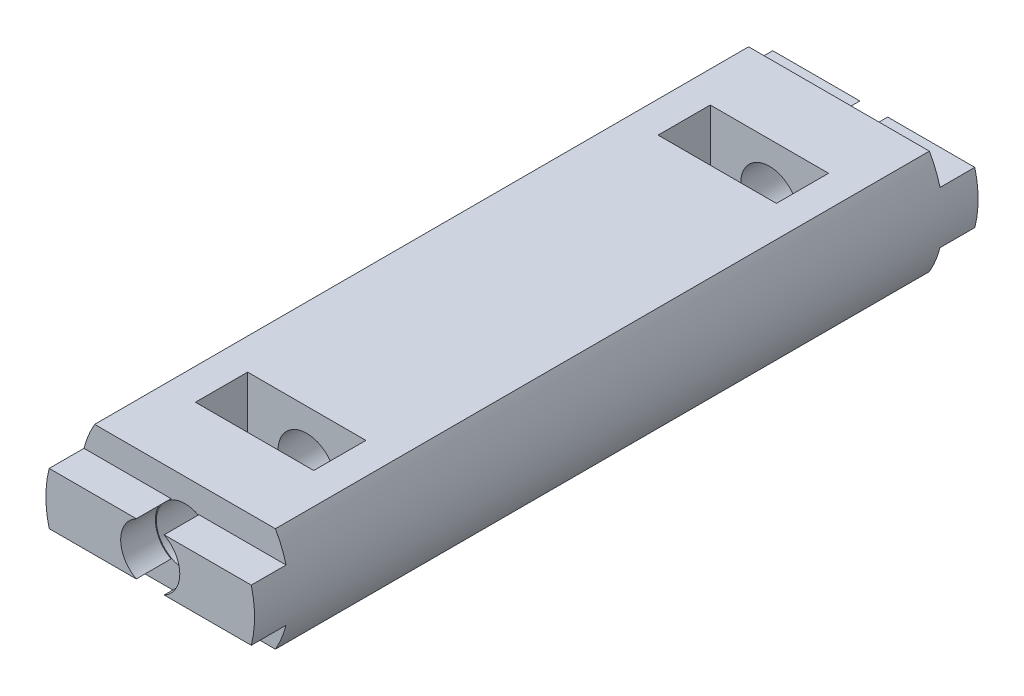
from build123d import *

# Parameters (mm, degrees)
ESBO_O1_R                     = 1.65
RESSALTO_EXTRUS_O1_DEPTH      = 37.6
RESSALTO_EXTRUS_O2_DEPTH      = 2
RESSALTO_EXTRUS_O2_DEPTH_BACK = 39.6
CORTE_EXTRUS_O1_DEPTH         = 41.164163131
CORTE_EXTRUS_O1_DEPTH_BACK    = 41.164163131
ESBO_O2_W                     = 6.8
ESBO_O2_H                     = 3


with BuildPart() as part:
    # Esboço1 → Ressalto-extrusão1 (new body)
    with BuildSketch(Plane.XY):
        with BuildLine():
            Line((-5.196152423, -3), (5.196152423, -3))
            ThreePointArc((5.196152423, -3), (6, 0), (5.196152423, 3))
            Line((5.196152423, 3), (-5.196152423, 3))
            ThreePointArc((-5.196152423, 3), (-6, 0), (-5.196152423, -3))
        make_face()
        Circle(ESBO_O1_R, mode=Mode.SUBTRACT)
    extrude(amount=RESSALTO_EXTRUS_O1_DEPTH)

    # Esboço3 → Ressalto-extrusão2 (add, two sides: drawn at the far end of the back side and taken through both)
    with BuildSketch(Plane(origin=(0, 0, 0), x_dir=(-1, 0, 0), z_dir=(0, 0, -1)).offset(-RESSALTO_EXTRUS_O2_DEPTH_BACK)):
        with BuildLine():
            Line((0.8, 1.5), (5.809475019, 1.5))
            ThreePointArc((5.809475019, 1.5), (6, 0), (5.809475019, -1.5))
            Line((5.809475019, -1.5), (0.8, -1.5))
            ThreePointArc((0.8, -1.5), (1.7, 0), (0.8, 1.5))
        make_face()
        with BuildLine():
            Line((-5.809475019, 1.5), (-0.8, 1.5))
            ThreePointArc((-0.8, 1.5), (-1.7, 0), (-0.8, -1.5))
            Line((-0.8, -1.5), (-5.809475019, -1.5))
            ThreePointArc((-5.809475019, -1.5), (-6, 0), (-5.809475019, 1.5))
        make_face()
    extrude(amount=RESSALTO_EXTRUS_O2_DEPTH + RESSALTO_EXTRUS_O2_DEPTH_BACK)

    # Esboço2 → Corte-extrusão1 (cut, two sides: drawn at the far end of the back side and taken through both)
    with BuildSketch(Plane(origin=(0, 0, 0), x_dir=(1, 0, 0), z_dir=(0, 1, 0)).offset(-CORTE_EXTRUS_O1_DEPTH_BACK)):
        with Locations((0, -5.5)):
            Rectangle(ESBO_O2_W, ESBO_O2_H)
        with Locations((0, -5.5)):
            Rectangle(ESBO_O2_W, ESBO_O2_H)
        with Locations((0, -32.1)):
            Rectangle(ESBO_O2_W, ESBO_O2_H)
        with Locations((0, -32.1)):
            Rectangle(ESBO_O2_W, ESBO_O2_H)
    extrude(amount=CORTE_EXTRUS_O1_DEPTH + CORTE_EXTRUS_O1_DEPTH_BACK, mode=Mode.SUBTRACT)


solid = part.part
